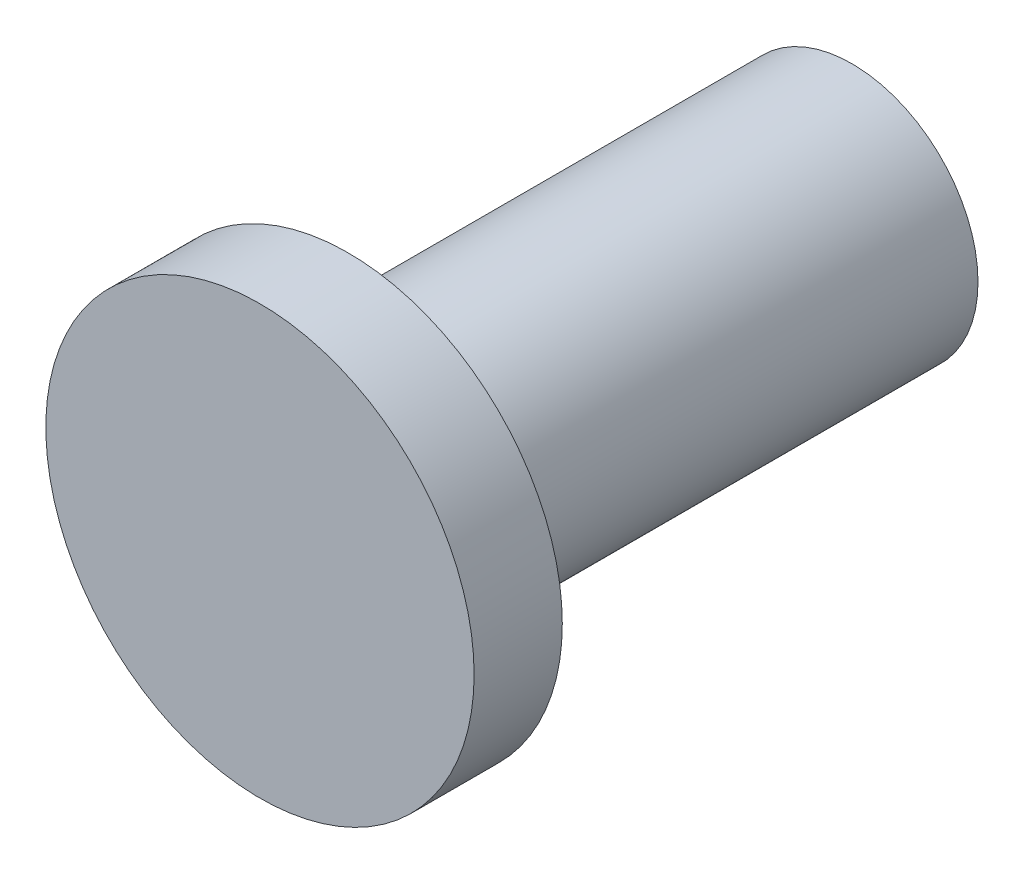
from build123d import *

# Parameters (mm, degrees)
THREAD_ENVELOPE_START = -4
SKETCH1_R             = 1
THREAD_ENVELOPE_DEPTH = 4
SKETCH2_R             = 1.7
HEAD_ENVELOPE_DEPTH   = 0.7


with BuildPart() as part:
    # Sketch1 → Thread_Envelope (new body)
    with BuildSketch(Plane.XY.offset(THREAD_ENVELOPE_START)):
        Circle(SKETCH1_R)
    extrude(amount=THREAD_ENVELOPE_DEPTH)

    # Sketch2 → Head_Envelope (add)
    with BuildSketch(Plane.XY):
        Circle(SKETCH2_R)
    extrude(amount=HEAD_ENVELOPE_DEPTH)


solid = part.part
